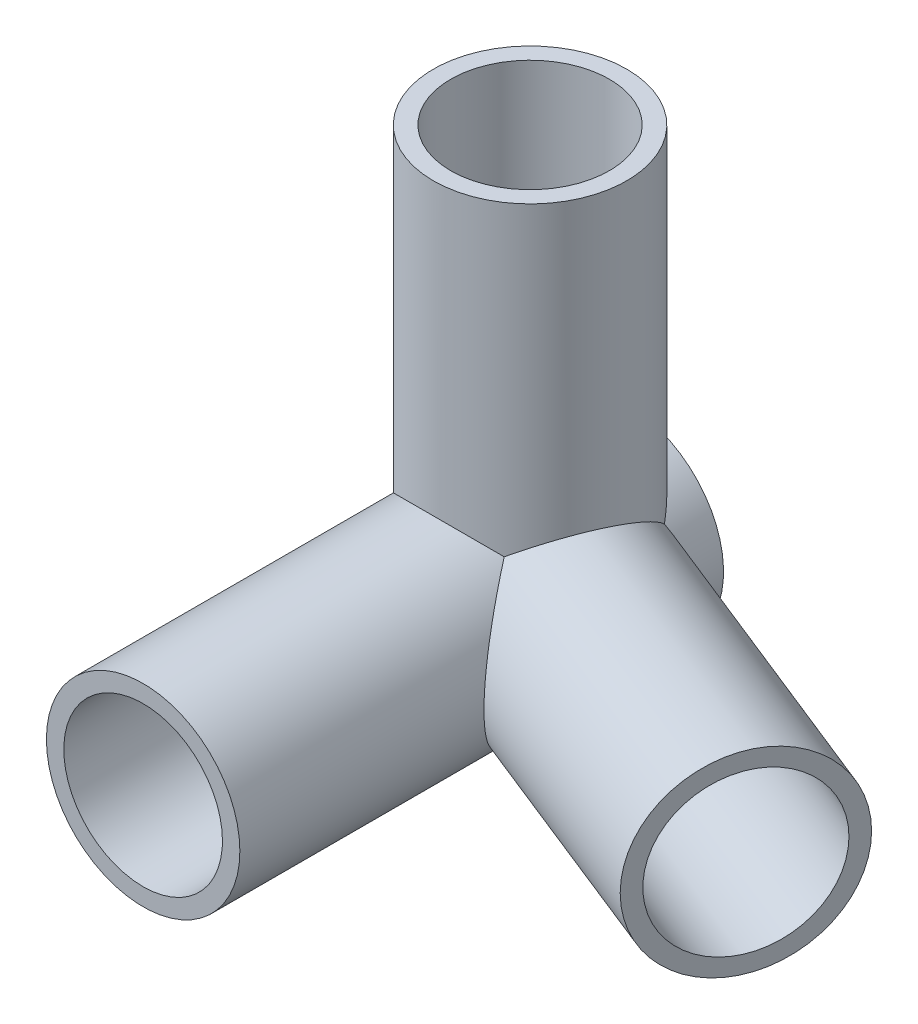
from build123d import *
from build123d.topology import SkipClean

# Parameters (mm, degrees)
EXTRUDE_1_DEPTH     = 25
SKETCH_3_R          = 4.999999999999999
SKETCH_3_R_2        = 4.1
EXTRUDE_3_DEPTH     = 20
SKETCH_5_R          = 4.1
CUT_EXTRUDE_1_DEPTH = 20
CUT_EXTRUDE_START   = -20
SKETCH_6_R          = 4.099999999999975
CUT_EXTRUDE_2_DEPTH = 20
SKETCH_8_R          = 4.1
CUT_EXTRUDE_3_DEPTH = 20
SKETCH_10_R         = 4.999999999999985
EXTRUDE_4_DEPTH     = 2
EXTRUDE_START       = 2
SKETCH_11_R         = 5.000000000000009
EXTRUDE_5_DEPTH     = 2
SKETCH_14_R         = 4.999999999999984
EXTRUDE_7_DEPTH     = 2
SKETCH_16_R         = 4.533551082343132
EXTRUDE_10_DEPTH    = 2
SKETCH_19_R         = 4.099999999999975
EXTRUDE_11_DEPTH    = 1


with BuildPart() as part:
    # 草图1 → 凸台-拉伸1 (new body)
    with BuildSketch(Plane.XY):
        with BuildLine():
            ThreePointArc((3.807664566389228, -1.520424463715221), (2.299593409579932, -3.3943880377199664), (-1.3869e-13, -4.099999999999997))
            Line((-2.505e-14, -4.099999999999997), (-2.505e-14, -4.999999999999999))
            ThreePointArc((4.064e-14, -4.999999999999999), (2.8043822068049016, -4.139497606975504), (4.643493373645423, -1.8541761752624288))
            Line((4.643493373645413, -1.8541761752624097), (3.807664566389235, -1.5204244637151874))
        make_face()
        with BuildLine():
            Line((-2.505e-14, -4.999999999999999), (-2.505e-14, -4.099999999999997))
            ThreePointArc((-1.3869e-13, -4.099999999999997), (-2.899137802864827, 2.899137802864883), (4.099999999999972, 0))
            ThreePointArc((4.099999999999972, -1e-15), (4.026252893336154, -0.7741367055643485), (3.807664566389228, -1.520424463715221))
            Line((3.807664566389235, -1.5204244637151874), (4.643493373645413, -1.8541761752624097))
            ThreePointArc((4.643493373645423, -1.8541761752624288), (4.910064504068492, -0.9440691531272374), (4.999999999999974, -1.22e-15))
            ThreePointArc((4.999999999999974, 0), (-3.535533905932785, 3.5355339059327138), (4.064e-14, -4.999999999999999))
        make_face()
        with BuildLine():
            ThreePointArc((3.807664566389228, -1.520424463715221), (2.299593409579932, -3.3943880377199664), (-1.3869e-13, -4.099999999999997))
            Line((-2.505e-14, -4.099999999999997), (-2.505e-14, -4.999999999999999))
            ThreePointArc((4.064e-14, -4.999999999999999), (2.8043822068049016, -4.139497606975504), (4.643493373645423, -1.8541761752624288))
            Line((4.643493373645413, -1.8541761752624097), (3.807664566389235, -1.5204244637151874))
        make_face()
        with BuildLine():
            Line((-2.505e-14, -4.999999999999999), (-2.505e-14, -4.099999999999997))
            ThreePointArc((-1.3869e-13, -4.099999999999997), (-2.899137802864827, 2.899137802864883), (4.099999999999972, 0))
            ThreePointArc((4.099999999999972, -1e-15), (4.026252893336154, -0.7741367055643485), (3.807664566389228, -1.520424463715221))
            Line((3.807664566389235, -1.5204244637151874), (4.643493373645413, -1.8541761752624097))
            ThreePointArc((4.643493373645423, -1.8541761752624288), (4.910064504068492, -0.9440691531272374), (4.999999999999974, -1.22e-15))
            ThreePointArc((4.999999999999974, 0), (-3.535533905932785, 3.5355339059327138), (4.064e-14, -4.999999999999999))
        make_face()
    extrude(amount=EXTRUDE_1_DEPTH)

    # 草图3 → 凸台-拉伸3 (add)
    with SkipClean():  # the faces are left unmerged after this step: merging them gives an invalid solid
        with BuildSketch(Plane(origin=(0, 0, 0), x_dir=(1, 0, 0), z_dir=(0, 1, 0))):
            with Locations(Location((-2.515e-14, -4.999999999999999, 0), (0, 0, 90))):
                Circle(SKETCH_3_R)
            with Locations(Location((-2.515e-14, -4.999999999999999, 0), (0, 0, 90))):
                Circle(SKETCH_3_R_2, mode=Mode.SUBTRACT)
        extrude(amount=EXTRUDE_3_DEPTH)

    # 草图4 → 旋转1 (revolve)
    with SkipClean():  # the faces are left unmerged after this step: merging them gives an invalid solid
        with BuildSketch(Plane(origin=(0, 0, 0), x_dir=(1, 0, 0), z_dir=(0, 1, 0)), mode=Mode.PRIVATE) as revolve_1_sk:
            Polygon((-2.515e-14, -4.999999999999999), (1.85440815312012, -0.35659926329403063), (20.428011099943994, -7.774231875774611), (18.573602946823843, -12.417632612480581), align=None)
        revolve(revolve_1_sk.sketch.rotate(Axis((-2.515e-14, 0, 4.999999999999999), (0.9286801473411936, 0, 0.37088163062402923)), 180), axis=Axis((-2.515e-14, 0, 4.999999999999999), (0.9286801473411936, 0, 0.37088163062402923)))

    # 草图5 → 切除-拉伸1 (cut)
    with SkipClean():  # the faces are left unmerged after this step: merging them gives an invalid solid
        with BuildSketch(Plane(origin=(20.295754983694184, 0, 8.105398532152275), x_dir=(0.37088163062402946, 0, -0.9286801473411936), z_dir=(0.9286801473411936, 0, 0.37088163062402946))):
            with Locations((-4.6434007367059795, 0)):
                Circle(SKETCH_5_R)
        extrude(amount=-CUT_EXTRUDE_1_DEPTH, mode=Mode.SUBTRACT)

    # 草图6 → 切除-拉伸2 (cut)
    with SkipClean():  # the faces are left unmerged after this step: merging them gives an invalid solid
        with BuildSketch(Plane.XY.offset(25).offset(CUT_EXTRUDE_START)):
            with Locations(Location((0, 0, 0), (0, 0, 180))):
                Circle(SKETCH_6_R)
        extrude(amount=CUT_EXTRUDE_2_DEPTH, mode=Mode.SUBTRACT)

    # 草图8 → 切除-拉伸3 (cut)
    with SkipClean():  # the faces are left unmerged after this step: merging them gives an invalid solid
        with BuildSketch(Plane(origin=(0, 20, 0), x_dir=(1, 0, 0), z_dir=(0, 1, 0)).offset(CUT_EXTRUDE_START)):
            with Locations(Location((-2.51e-14, -4.999999999999999, 0), (0, 0, 68.23))):
                Circle(SKETCH_8_R)
        extrude(amount=CUT_EXTRUDE_3_DEPTH, mode=Mode.SUBTRACT)

    # 草图10 → 凸台-拉伸4 (add)
    with SkipClean():  # the faces are left unmerged after this step: merging them gives an invalid solid
        with BuildSketch(Plane.XY.offset(10)):
            with Locations(Location((0, 0, 0), (0, 0, 180))):
                Circle(SKETCH_10_R)
        extrude(amount=EXTRUDE_4_DEPTH)

    # 草图11 → 凸台-拉伸5 (add)
    with SkipClean():  # the faces are left unmerged after this step: merging them gives an invalid solid
        with BuildSketch(Plane(origin=(6.365552773576271, 0, 2.5421740727918305), x_dir=(0.37088163062402946, 0, -0.9286801473411936), z_dir=(0.9286801473411936, 0, 0.37088163062402946)).offset(EXTRUDE_START)):
            with Locations(Location((-4.6434007367059795, 0, 0), (0, 0, 180))):
                Circle(SKETCH_11_R)
        extrude(amount=-EXTRUDE_5_DEPTH)

    # 草图14 → 凸台-拉伸7 (add)
    with SkipClean():  # the faces are left unmerged after this step: merging them gives an invalid solid
        with BuildSketch(Plane(origin=(0, 5.000000000000001, 0), x_dir=(1, 0, 0), z_dir=(0, 1, 0))):
            with Locations(Location((4.57e-15, -5.000000000000001, 0), (0, 0, 90))):
                Circle(SKETCH_14_R)
        extrude(amount=EXTRUDE_7_DEPTH)

    # 草图16 → 凸台-拉伸10 (add)
    with SkipClean():  # the faces are left unmerged after this step: merging them gives an invalid solid
        with BuildSketch(Plane(origin=(0, 0, 0), x_dir=(-1, 0, 0), z_dir=(0, 0, -1))):
            Circle(SKETCH_16_R)
        extrude(amount=-EXTRUDE_10_DEPTH)

    # 草图19 → 凸台-拉伸11 (add)
    with SkipClean():  # the faces are left unmerged after this step: merging them gives an invalid solid
        with BuildSketch(Plane(origin=(0, 7.000000000000001, 0), x_dir=(1, 0, 0), z_dir=(0, 1, 0))):
            with Locations(Location((4.57e-15, -5.000000000000001, 0), (0, 0, 270))):
                Circle(SKETCH_19_R)
        extrude(amount=EXTRUDE_11_DEPTH)


solid = part.part
